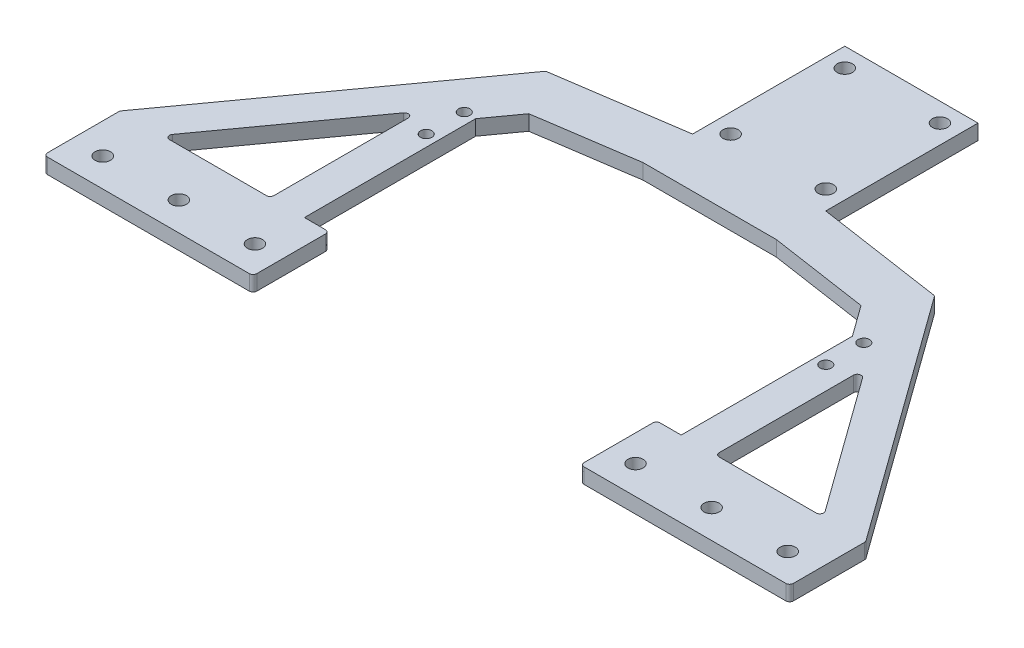
from build123d import *

# Parameters (mm, degrees)
SKETCH_1_R          = 2
EXTRUDE_1_DEPTH     = 4
SKETCH_2_R          = 1.5
SKETCH_2_R_2        = 2
EXTRUDE_2_DEPTH     = 4
CUT_EXTRUDE_1_DEPTH = 174.943237868
FILLET_2_R          = 1
FILLET_3_R          = 1


with BuildPart() as part:
    # 草图1 → 凸台-拉伸1 (new body)
    with BuildSketch(Plane(origin=(0, 0, 0), x_dir=(1, 0, 0), z_dir=(0, 1, 0))):
        Polygon((0, 0), (0, -110), (-62.5, -110), (-62.5, -130), (97.5, -130), (97.5, -110), (35, -110), (35, 0), align=None)
        with Locations(Location((5, -5, 0), (0, 0, 270))):
            Circle(SKETCH_1_R, mode=Mode.SUBTRACT)
        with Locations(Location((30, -5, 0), (0, 0, 270))):
            Circle(SKETCH_1_R, mode=Mode.SUBTRACT)
        with Locations(Location((5, -35, 0), (0, 0, 270))):
            Circle(SKETCH_1_R, mode=Mode.SUBTRACT)
        with Locations(Location((30, -35, 0), (0, 0, 270))):
            Circle(SKETCH_1_R, mode=Mode.SUBTRACT)
        with Locations(Location((-52.5, -122.5, 0), (0, 0, 270))):
            Circle(SKETCH_1_R, mode=Mode.SUBTRACT)
        with Locations(Location((-32.5, -122.5, 0), (0, 0, 270))):
            Circle(SKETCH_1_R, mode=Mode.SUBTRACT)
        with Locations(Location((-12.5, -122.5, 0), (0, 0, 270))):
            Circle(SKETCH_1_R, mode=Mode.SUBTRACT)
        with Locations(Location((7.5, -122.5, 0), (0, 0, 270))):
            Circle(SKETCH_1_R, mode=Mode.SUBTRACT)
        with Locations(Location((27.5, -122.5, 0), (0, 0, 270))):
            Circle(SKETCH_1_R, mode=Mode.SUBTRACT)
        with Locations(Location((47.5, -122.5, 0), (0, 0, 270))):
            Circle(SKETCH_1_R, mode=Mode.SUBTRACT)
        with Locations(Location((67.5, -122.5, 0), (0, 0, 270))):
            Circle(SKETCH_1_R, mode=Mode.SUBTRACT)
        with Locations(Location((87.5, -122.5, 0), (0, 0, 270))):
            Circle(SKETCH_1_R, mode=Mode.SUBTRACT)
    extrude(amount=EXTRUDE_1_DEPTH)

    # 草图2 → 凸台-拉伸2 (add)
    # profile 1 of 2: a face of its own
    with BuildSketch(Plane(origin=(0, 4, 0), x_dir=(1, 0, 0), z_dir=(0, 1, 0))):
        Polygon((0, -40), (0, -53), (-26.149225941, -56.891259047), (-32, -65), (-32, -110), (-41, -110), (-41, -70.637206461), (-69.401796613, -110), (-62.5, -110), (-62.5, -130), (-80.5, -130), (-80.5, -110), (-33.599955214, -45), align=None)
        with Locations(Location((-35, -65, 0), (0, 0, 270))):
            Circle(SKETCH_2_R, mode=Mode.SUBTRACT)
        with Locations(Location((-35, -75, 0), (0, 0, 270))):
            Circle(SKETCH_2_R, mode=Mode.SUBTRACT)
        with Locations(Location((-72.5, -122.5, 0), (0, 0, 270))):
            Circle(SKETCH_2_R_2, mode=Mode.SUBTRACT)
    # profile 2 of 2: a face of its own
    with BuildSketch(Plane(origin=(0, 4, 0), x_dir=(1, 0, 0), z_dir=(0, 1, 0))):
        Polygon((67, -65), (67, -110), (76, -110), (76, -70.637206461), (104.401796613, -110), (97.5, -110), (97.5, -130), (115.5, -130), (115.5, -110), (68.599955214, -45), (35, -40), (35, -53), (61.149225941, -56.891259047), align=None)
        with Locations(Location((70, -65, 0), (0, 0, 270))):
            Circle(SKETCH_2_R, mode=Mode.SUBTRACT)
        with Locations(Location((70, -75, 0), (0, 0, 270))):
            Circle(SKETCH_2_R, mode=Mode.SUBTRACT)
        with Locations(Location((107.5, -122.5, 0), (0, 0, 270))):
            Circle(SKETCH_2_R_2, mode=Mode.SUBTRACT)
    extrude(amount=-EXTRUDE_2_DEPTH)

    # 草图3 → 切除-拉伸1 (cut, through all)
    with BuildSketch(Plane(origin=(0, 4, 0), x_dir=(1, 0, 0), z_dir=(0, 1, 0))):
        Polygon((0, -53), (35, -53), (35, -110), (60.5, -110), (60.5, -130), (-25.5, -130), (-25.5, -110), (0, -110), align=None)
    extrude(amount=-CUT_EXTRUDE_1_DEPTH, mode=Mode.SUBTRACT)

    # 圆角2
    fillet_2_edges = [part.edges().sort_by_distance(p)[0] for p in [
        (76, 2, 70.637206461),
        (104.401796613, 2, 110),
        (76, 2, 110),
        (-41, 2, 70.637206461),
        (-41, 2, 110),
        (-69.401796613, 2, 110),
    ]]
    fillet(fillet_2_edges, radius=FILLET_2_R)

    # 圆角3
    fillet_3_edges = [part.edges().sort_by_distance(p)[0] for p in [
        (115.5, 2, 130),
        (115.5, 2, 110),
        (68.599955214, 2, 45),
        (60.5, 2, 110),
        (60.5, 2, 130),
        (-25.5, 2, 130),
        (-25.5, 2, 110),
        (-33.599955214, 2, 45),
        (-80.5, 2, 110),
        (-80.5, 2, 130),
    ]]
    fillet(fillet_3_edges, radius=FILLET_3_R)


solid = part.part
